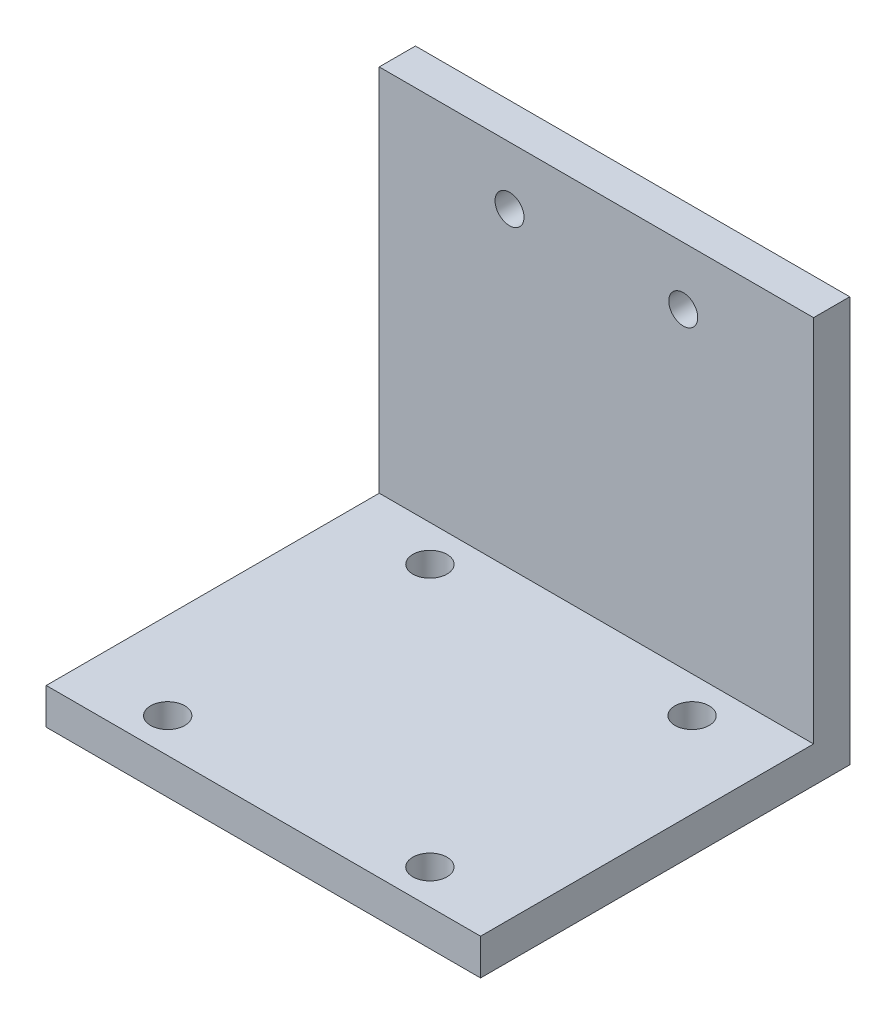
from build123d import *

# Parameters (mm, degrees)
SKETCH1_W                  = 38.1
SKETCH1_H                  = 10.16
SKETCH1_R                  = 1.27
BOSS_EXTRUDE3_DEPTH        = 3.175
SKETCH7_W                  = 38.1
SKETCH7_H                  = 3.175
BOSS_EXTRUDE4_DEPTH        = 25.4
SKETCH8_W                  = 38.1
SKETCH8_H                  = 3.175
BOSS_EXTRUDE6_DEPTH        = 29.21
F_1_0_228_DIAMETER_HOLE1_D = 3.000000096


with BuildPart() as part:
    # Sketch1 → Boss-Extrude3 (new body)
    with BuildSketch(Plane.XY):
        with Locations((8.461414392, 6.372059553)):
            Rectangle(SKETCH1_W, SKETCH1_H)
        with Locations((16.081414392, 6.372059553)):
            Circle(SKETCH1_R, mode=Mode.SUBTRACT)
        with Locations((0.841414392, 6.372059553)):
            Circle(SKETCH1_R, mode=Mode.SUBTRACT)
    extrude(amount=-BOSS_EXTRUDE3_DEPTH)

    # Sketch7 → Boss-Extrude4 (add)
    with BuildSketch(Plane.XZ.offset(-1.292059553)):
        with Locations((8.461414392, -1.5875)):
            Rectangle(SKETCH7_W, SKETCH7_H)
    extrude(amount=BOSS_EXTRUDE4_DEPTH)

    # Sketch8 → Boss-Extrude6 (add)
    with BuildSketch(Plane.XY):
        with Locations((8.461414392, -22.520440447)):
            Rectangle(SKETCH8_W, SKETCH8_H)
    extrude(amount=BOSS_EXTRUDE6_DEPTH)

    # #1 (0.228) Diameter Hole1 (through all)
    with Locations(Plane(origin=(-2.968585608, -24.107940447, 3.175), x_dir=(0, 0, -1), z_dir=(0, -1, 0))):
        with Locations((0, 0), (0, 23), (-23, 23), (-23, 0)):
            Hole(F_1_0_228_DIAMETER_HOLE1_D / 2)


solid = part.part
